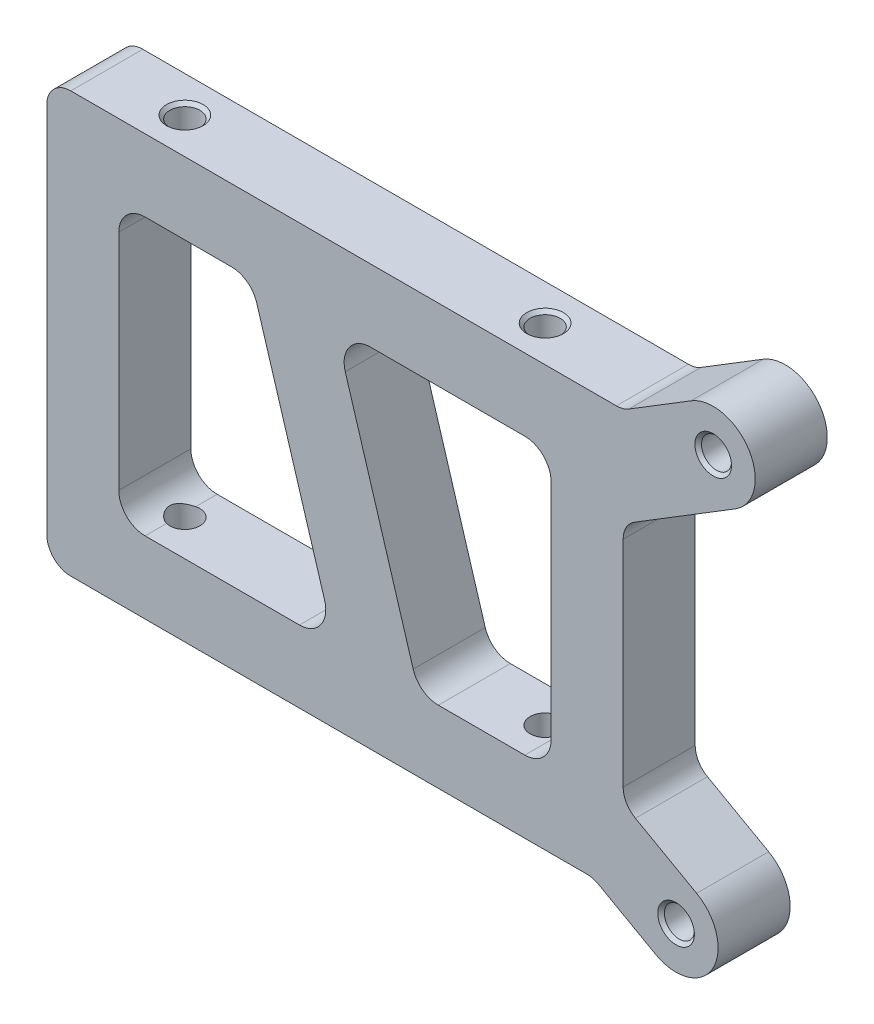
from build123d import *

# Parameters (mm, degrees)
EXTRUDE_1_DEPTH              = 6
EXTRUDE_2_DEPTH              = 6
HOLE_WIZARD_M3_1_D           = 2.5
HOLE_WIZARD_M3_1_CSINK_D     = 3.05
HOLE_WIZARD_M3_1_CSINK_ANGLE = 90
HOLE_WIZARD_M3_2_D           = 2.5
HOLE_WIZARD_M3_2_CSINK_D     = 3.05
HOLE_WIZARD_M3_2_CSINK_ANGLE = 90


with BuildPart() as part:
    # 草图1 → 凸台-拉伸1 (new body)
    with BuildSketch(Plane.XY):
        with BuildLine():
            Line((0, 0), (-46, 0))
            ThreePointArc((-46, 0), (-47.414213562, 0.585786438), (-48, 2))
            Line((-48, 2), (-48, 33))
            ThreePointArc((-48, 33), (-47.414213562, 34.414213562), (-46, 35))
            Line((-46, 35), (0, 35))
            Line((0, 35), (0, 0))
        make_face()
        with BuildLine():
            Line((-30.514833292, 27.446840468), (-24.85843299, 8.825962624))
            ThreePointArc((-24.85843299, 8.825962624), (-25.194545135, 6.885579165), (-26.953467783, 6))
            Line((-26.953467783, 6), (-39.810438922, 6))
            ThreePointArc((-39.810438922, 6), (-41.358692408, 6.641307592), (-42, 8.189561078))
            Line((-42, 8.189561078), (-42, 26.810438922))
            ThreePointArc((-42, 26.810438922), (-41.358692408, 28.358692408), (-39.810438922, 29))
            Line((-39.810438922, 29), (-32.609868086, 29))
            ThreePointArc((-32.609868086, 29), (-31.305886173, 28.569361571), (-30.514833292, 27.446840468))
        make_face(mode=Mode.SUBTRACT)
        with BuildLine():
            Line((-6, 26.810438922), (-6, 8.189561078))
            ThreePointArc((-6, 8.189561078), (-6.641307592, 6.641307592), (-8.189561078, 6))
            Line((-8.189561078, 6), (-15.390131914, 6))
            ThreePointArc((-15.390131914, 6), (-16.694113827, 6.430638429), (-17.485166708, 7.553159532))
            Line((-17.485166708, 7.553159532), (-23.14156701, 26.174037376))
            ThreePointArc((-23.14156701, 26.174037376), (-22.805454865, 28.114420835), (-21.046532217, 29))
            Line((-21.046532217, 29), (-8.189561078, 29))
            ThreePointArc((-8.189561078, 29), (-6.641307592, 28.358692408), (-6, 26.810438922))
        make_face(mode=Mode.SUBTRACT)
    extrude(amount=EXTRUDE_1_DEPTH)

    # 草图3 → 凸台-拉伸2 (add)
    with BuildSketch(Plane.XY.offset(6)):
        with BuildLine():
            Line((5.667856321, 38.482155184), (0.48165081, 35.295911324))
            ThreePointArc((0.48165081, 35.295911324), (-0.021311116, 35.075399086), (-0.565288435, 35))
            Line((-0.565288435, 35), (-3.393768866, 35))
            Line((-3.393768866, 35), (-3.393768866, 0))
            Line((-3.393768866, 0), (-3.026694271, 0))
            ThreePointArc((-3.026694271, 0), (-2.520753033, -0.065052077), (-2.047724325, -0.255976536))
            Line((-2.047724325, -0.255976536), (2.692773727, -2.916952845))
            ThreePointArc((2.692773727, -2.916952845), (7.458012195, -1.578109188), (6.119168538, 3.187129281))
            Line((6.119168538, 3.187129281), (1.021030054, 6.048859331))
            ThreePointArc((1.021030054, 6.048859331), (0.274030723, 6.782422478), (0, 7.792882796))
            Line((0, 7.792882796), (0, 25.665907397))
            ThreePointArc((0, 25.665907397), (0.254451592, 26.642155703), (0.953060755, 27.369996073))
            Line((0.953060755, 27.369996073), (9.332143679, 32.517844816))
            ThreePointArc((9.332143679, 32.517844816), (10.482155184, 37.332143679), (5.667856321, 38.482155184))
        make_face()
    extrude(amount=-EXTRUDE_2_DEPTH)

    # M3 螺纹孔1 (through all)
    with Locations(Plane.XY.offset(6)):
        with Locations((7.5, 35.5), (4.405971132, 0.135088218)):
            CounterSinkHole(HOLE_WIZARD_M3_1_D / 2, HOLE_WIZARD_M3_1_CSINK_D / 2, counter_sink_angle=HOLE_WIZARD_M3_1_CSINK_ANGLE)

    # M3 螺纹孔2 (through all)
    with Locations(Plane(origin=(0, 35, 0), x_dir=(1, 0, 0), z_dir=(0, 1, 0))):
        with Locations((-39.5, -3), (-9.5, -3)):
            CounterSinkHole(HOLE_WIZARD_M3_2_D / 2, HOLE_WIZARD_M3_2_CSINK_D / 2, counter_sink_angle=HOLE_WIZARD_M3_2_CSINK_ANGLE)


solid = part.part
